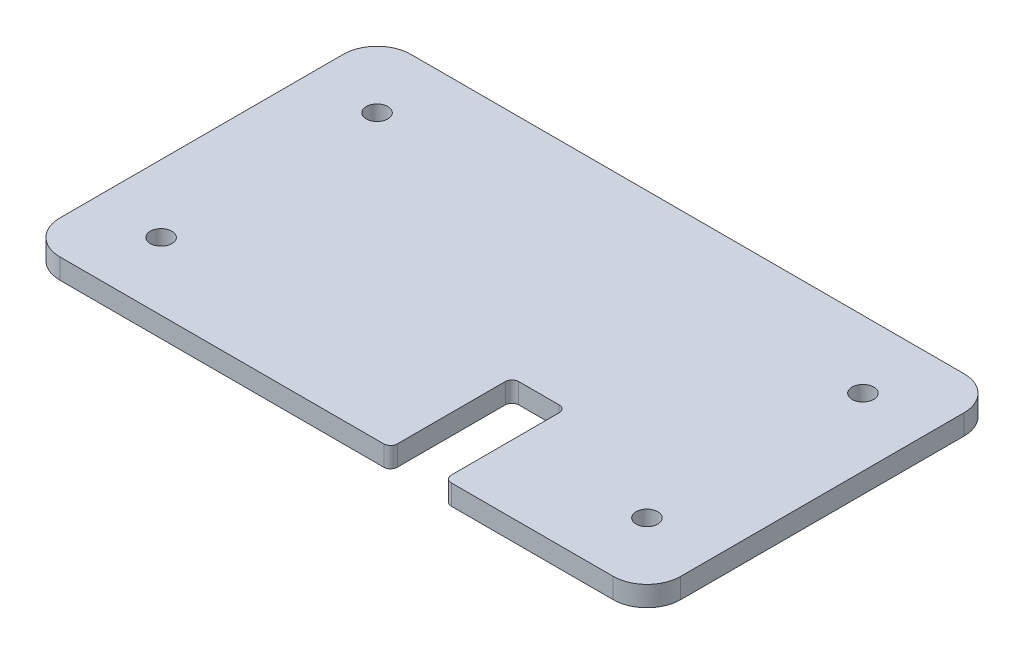
from build123d import *

# Parameters (mm, degrees)
SKETCH_1_R      = 1.6
EXTRUDE_1_DEPTH = 3
FILLET_1_R      = 5
FILLET_2_R      = 1


with BuildPart() as part:
    # 草图1 → 凸台-拉伸1 (new body)
    with BuildSketch(Plane(origin=(0, 0, 0), x_dir=(1, 0, 0), z_dir=(0, 1, 0))):
        Polygon((8, -26), (8, -8), (16, -8), (16, -26), (46, -26), (46, 26), (-46, 26), (-46, -26), align=None)
        with Locations(Location((-36, 16, 0), (0, 0, 270))):
            Circle(SKETCH_1_R, mode=Mode.SUBTRACT)
        with Locations(Location((-36, -16, 0), (0, 0, 270))):
            Circle(SKETCH_1_R, mode=Mode.SUBTRACT)
        with Locations(Location((36, -16, 0), (0, 0, 270))):
            Circle(SKETCH_1_R, mode=Mode.SUBTRACT)
        with Locations(Location((36, 16, 0), (0, 0, 270))):
            Circle(SKETCH_1_R, mode=Mode.SUBTRACT)
    extrude(amount=EXTRUDE_1_DEPTH)

    # 圆角1
    fillet_1_edges = [part.edges().sort_by_distance(p)[0] for p in [
        (-46, 1.5, 26),
        (-46, 1.5, -26),
        (46, 1.5, -26),
        (46, 1.5, 26),
    ]]
    fillet(fillet_1_edges, radius=FILLET_1_R)

    # 圆角2
    fillet_2_edges = [part.edges().sort_by_distance(p)[0] for p in [
        (16, 1.5, 26),
        (16, 1.5, 8),
        (8, 1.5, 8),
        (8, 1.5, 26),
    ]]
    fillet(fillet_2_edges, radius=FILLET_2_R)


solid = part.part
